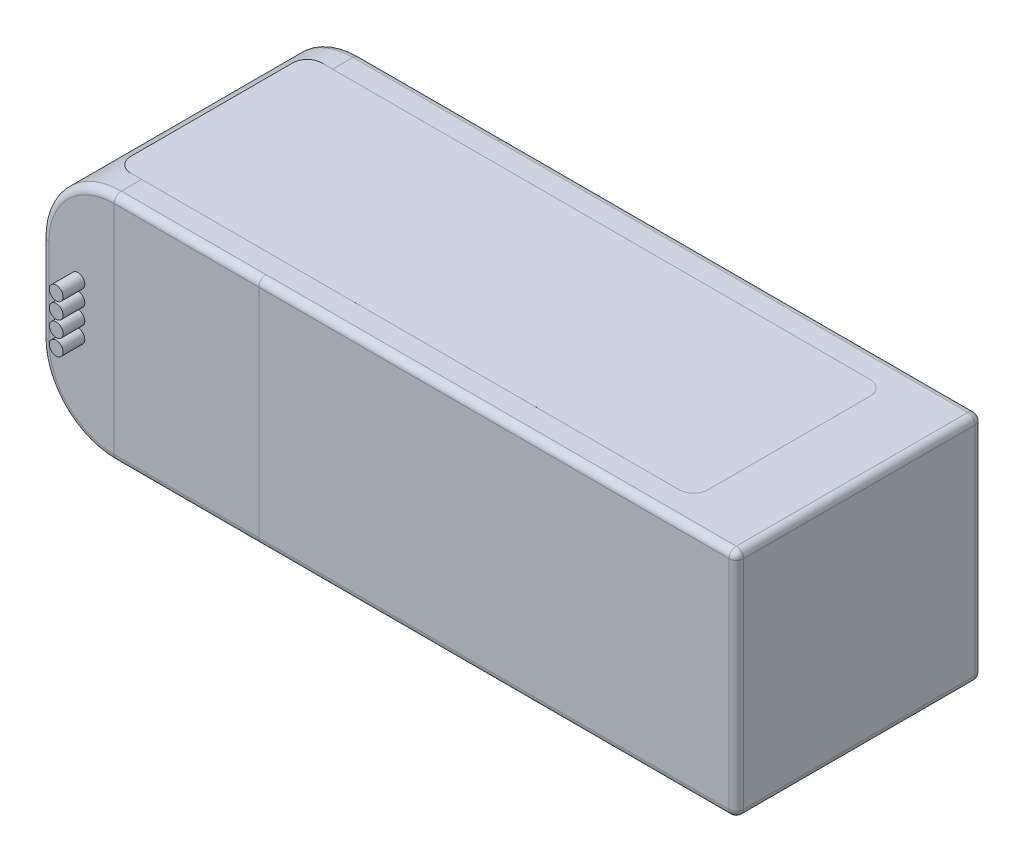
from build123d import *

# Parameters (mm, degrees)
SKETCH1_W           = 96
SKETCH1_H           = 34
BOSS_EXTRUDE1_DEPTH = 16
FILLET1_R           = 10
SKETCH2_R           = 1.9
BOSS_EXTRUDE2_DEPTH = 5
SKETCH4_R           = 0.95
BOSS_EXTRUDE3_DEPTH = 3
SKETCH5_W           = 20
SKETCH5_H           = 32
BOSS_EXTRUDE4_DEPTH = 0.0001
BOSS_EXTRUDE5_DEPTH = 0.0001
BOSS_EXTRUDE6_DEPTH = 0.0001
FILLET7_R           = 1
FILLET8_R           = 1


with BuildPart() as part:
    # Sketch1 → Boss-Extrude1 (new, symmetric)
    with BuildSketch(Plane(origin=(0, 0, 0), x_dir=(1, 0, 0), z_dir=(0, 1, 0))):
        Rectangle(SKETCH1_W, SKETCH1_H)
    extrude(amount=BOSS_EXTRUDE1_DEPTH, both=True)

    # Fillet1
    fillet1_edges = [part.edges().sort_by_distance(p)[0] for p in [
        (-48, 16, 0),
        (-48, -16, 0),
    ]]
    fillet(fillet1_edges, radius=FILLET1_R)

    # Sketch2 → Boss-Extrude2 (add)
    with BuildSketch(Plane(origin=(0, 0, -17), x_dir=(-1, 0, 0), z_dir=(0, 0, -1))):
        with Locations(Location((40, 3.35, 0), (0, 0, 180))):
            Circle(SKETCH2_R)
        with Locations(Location((40, -3.35, 0), (0, 0, 180))):
            Circle(SKETCH2_R)
    extrude(amount=BOSS_EXTRUDE2_DEPTH)

    # Sketch4 → Boss-Extrude3 (add)
    with BuildSketch(Plane.XY.offset(17)):
        with Locations(Location((-43, 3.3, 0), (0, 0, 180))):
            Circle(SKETCH4_R)
        with Locations(Location((-43, 1.1, 0), (0, 0, 180))):
            Circle(SKETCH4_R)
        with Locations(Location((-43, -1.1, 0), (0, 0, 180))):
            Circle(SKETCH4_R)
        with Locations(Location((-43, -3.3, 0), (0, 0, 180))):
            Circle(SKETCH4_R)
    extrude(amount=BOSS_EXTRUDE3_DEPTH)

    # Sketch5 → Boss-Extrude4 (add)
    with BuildSketch(Plane.XY.offset(17)):
        with Locations((-28, 0)):
            Rectangle(SKETCH5_W, SKETCH5_H)
    boss_extrude4 = extrude(amount=BOSS_EXTRUDE4_DEPTH)

    # Mirror1: Boss-Extrude4 across plane
    add(boss_extrude4.mirror(Plane.XY))

    # Mirror1 at the second plane: Boss-Extrude4 across plane
    add(boss_extrude4.mirror(Plane.ZX))

    # Sketch6 → Boss-Extrude5 (add)
    with BuildSketch(Plane(origin=(0, 16, 0), x_dir=(1, 0, 0), z_dir=(0, 1, 0))):
        with BuildLine():
            Line((-39.5, 13.2), (36.3, 13.2))
            ThreePointArc((36.3, 13.2), (37.714213562, 12.614213562), (38.3, 11.2))
            Line((38.3, 11.2), (38.3, -11.2))
            ThreePointArc((38.3, -11.2), (37.714213562, -12.614213562), (36.3, -13.2))
            Line((36.3, -13.2), (-39.5, -13.2))
            ThreePointArc((-39.5, -13.2), (-40.914213562, -12.614213562), (-41.5, -11.2))
            Line((-41.5, -11.2), (-41.5, 11.2))
            ThreePointArc((-41.5, 11.2), (-40.914213562, 12.614213562), (-39.5, 13.2))
        make_face()
    extrude(amount=BOSS_EXTRUDE5_DEPTH)

    # Sketch7 → Boss-Extrude6 (add)
    with BuildSketch(Plane.XZ.offset(16)):
        with BuildLine():
            Line((-27.6, 12.5), (23.3, 12.5))
            ThreePointArc((23.3, 12.5), (24.714213562, 11.914213562), (25.3, 10.5))
            Line((25.3, 10.5), (25.3, -10.5))
            ThreePointArc((25.3, -10.5), (24.714213562, -11.914213562), (23.3, -12.5))
            Line((23.3, -12.5), (-27.6, -12.5))
            ThreePointArc((-27.6, -12.5), (-29.014213562, -11.914213562), (-29.6, -10.5))
            Line((-29.6, -10.5), (-29.6, 10.5))
            ThreePointArc((-29.6, 10.5), (-29.014213562, 11.914213562), (-27.6, 12.5))
        make_face()
    extrude(amount=BOSS_EXTRUDE6_DEPTH)

    # Fillet7
    fillet7_edges = [part.edges().sort_by_distance(p)[0] for p in [
        (48, 16, 0),
        (-48, 0, 17),
        (-48, 0, -17),
        (15, 16, -17),
        (-45.071067812, 13.071067812, 17),
        (-45.071067812, -13.071067812, 17),
        (-45.071067812, 13.071067812, -17),
        (-45.071067812, -13.071067812, -17),
        (15, -16, -17),
        (48, -16, 0),
        (15, -16, 17),
        (15, 16, 17),
        (48, 0, -17),
        (48, 0, 17),
    ]]
    fillet(fillet7_edges, radius=FILLET7_R)

    # Fillet8
    fillet8_edges = [part.edges().sort_by_distance(p)[0] for p in [
        (-28, -16, 17.0001),
        (-28, 16, 17.0001),
        (-28, 16, -17.0001),
        (-28, -16, -17.0001),
    ]]
    fillet(fillet8_edges, radius=FILLET8_R)


solid = part.part
